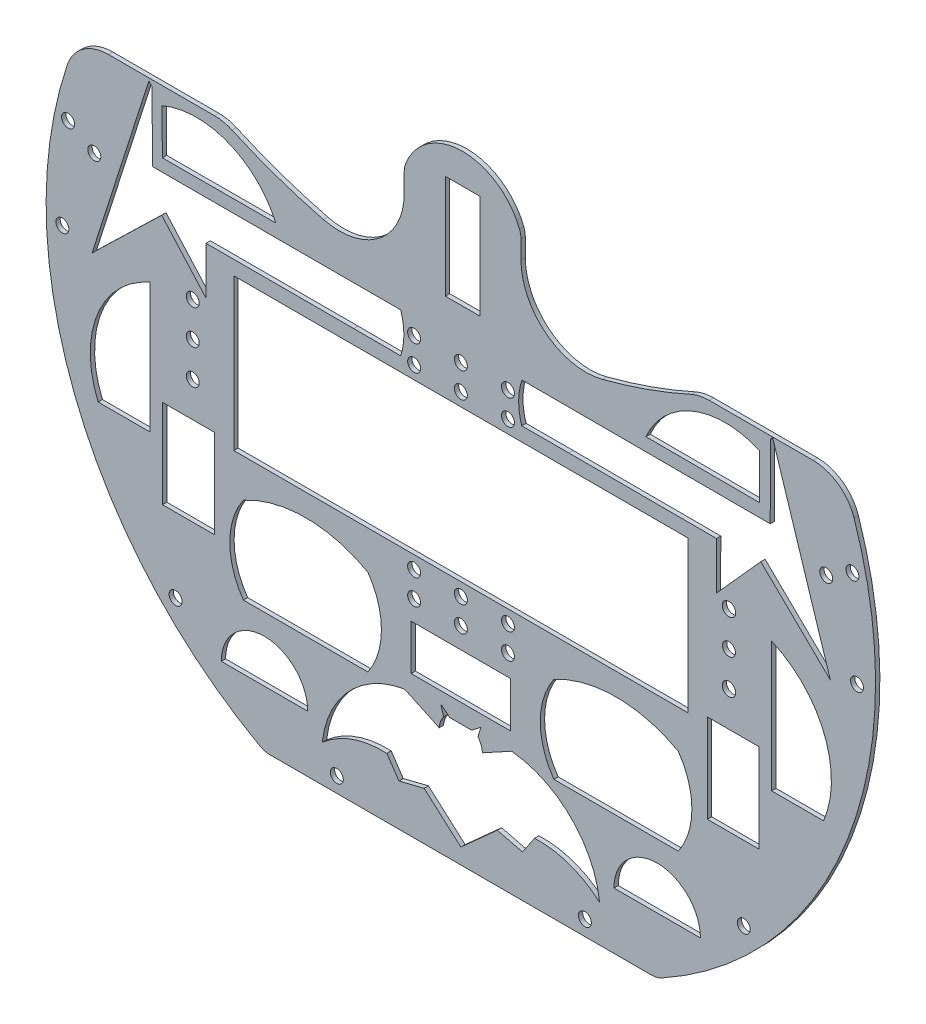
from build123d import *

# Parameters (mm, degrees)
CROQUIS1_R              = 1.5
CROQUIS1_W              = 23
CROQUIS1_H              = 10.5
CROQUIS1_R_2            = 1.55
CROQUIS1_W_2            = 8
CROQUIS1_H_2            = 24
SALIENTE_EXTRUIR1_DEPTH = 1


with BuildPart() as part:
    # Croquis1 → Saliente-Extruir1 (new body)
    with BuildSketch(Plane.XY):
        with BuildLine():
            ThreePointArc((309.850726744, 63.509654663), (309.599394258, 62.624115136), (309.514659431, 61.707508197))
            Line((309.514659431, 61.707508197), (309.514659431, 57.327552176))
            ThreePointArc((309.514659431, 57.327552176), (303.729213281, 45.491505651), (290.835726452, 42.785700432))
            ThreePointArc((290.835726452, 42.785700432), (280.128411441, 45.991903753), (269.737322706, 50.109136972))
            ThreePointArc((269.737322706, 50.109136972), (267.74260814, 50.759780707), (265.656038098, 50.97989188))
            Line((265.656038098, 50.97989188), (241.08166038, 50.97989188))
            ThreePointArc((241.08166038, 50.97989188), (235.230334816, 49.089268499), (231.591539837, 44.13228971))
            ThreePointArc((231.591539837, 44.13228971), (233.256794927, -20.949922712), (276.095054953, -69.973905885))
            ThreePointArc((276.095054953, -69.973905885), (277.267588571, -70.441900659), (278.519966502, -70.601286078))
            Line((278.519966502, -70.601286078), (293.924380078, -70.601286078))
            Line((293.924380078, -70.601286078), (366.696152251, -70.601286078))
            ThreePointArc((366.696152251, -70.601286078), (367.948530182, -70.441900659), (369.121063801, -69.973905885))
            ThreePointArc((369.121063801, -69.973905885), (412.002341733, -20.83942385), (413.549540259, 44.357259338))
            ThreePointArc((413.549540259, 44.357259338), (409.908538666, 49.29800924), (404.067243855, 51.18140435))
            Line((404.067243855, 51.18140435), (380.008708846, 51.18140435))
            ThreePointArc((380.008708846, 51.18140435), (377.904907933, 50.95760104), (375.895274543, 50.296208695))
            ThreePointArc((375.895274543, 50.296208695), (365.751190215, 46.2242243), (355.299933141, 43.021923672))
            ThreePointArc((355.299933141, 43.021923672), (342.343405641, 45.666690288), (336.514525798, 57.536423018))
            Line((336.514525798, 57.536423018), (336.514525798, 61.707508197))
            ThreePointArc((336.514525798, 61.707508197), (336.429790971, 62.624115136), (336.178458485, 63.509654663))
            ThreePointArc((336.178458485, 63.509654663), (323.014592614, 72.53553857), (309.850726744, 63.509654663))
        make_face()
        with Locations((256.640896295, -50.101286078)):
            Circle(CROQUIS1_R, mode=Mode.SUBTRACT)
        with Locations((293.924380078, -67.101286078)):
            Circle(CROQUIS1_R, mode=Mode.SUBTRACT)
        with BuildLine():
            Line((287.201459209, -57.50788535), (267.201459209, -57.50788535))
            ThreePointArc((267.201459209, -57.50788535), (277.201459209, -47.50788535), (287.201459209, -57.50788535))
        make_face(mode=Mode.SUBTRACT)
        Polygon((259.608059377, -32.937061776), (253.608059377, -32.937061776), (253.608059377, -12.437061776), (265.608059377, -12.437061776), (265.608059377, -32.937061776), align=None, mode=Mode.SUBTRACT)
        with BuildLine():
            Line((250.731722484, 10.184978786), (250.731722484, -19.815021214))
            Line((250.731722484, -19.815021214), (238.731722484, -19.815021214))
            ThreePointArc((238.731722484, -19.815021214), (238.55388558, -2.343886452), (250.731722484, 10.184978786))
        make_face(mode=Mode.SUBTRACT)
        with Locations((260.608059377, -4.351286077)):
            Circle(CROQUIS1_R, mode=Mode.SUBTRACT)
        with BuildLine():
            ThreePointArc((301.108080537, -22.687061776), (304.239766137, -32.687061776), (301.108080537, -42.687061776))
            Line((301.108080537, -42.687061776), (272.308080537, -42.687061776))
            ThreePointArc((272.308080537, -42.687061776), (269.176394936, -32.687061776), (272.308080537, -22.687061776))
            ThreePointArc((272.308080537, -22.687061776), (286.708080537, -18.980626962), (301.108080537, -22.687061776))
        make_face(mode=Mode.SUBTRACT)
        with Locations((311.80644959, -22.701286077)):
            Circle(CROQUIS1_R, mode=Mode.SUBTRACT)
        with Locations((322.608059377, -22.701286077)):
            Circle(CROQUIS1_R, mode=Mode.SUBTRACT)
        with Locations((311.80644959, -16.851286077)):
            Circle(CROQUIS1_R, mode=Mode.SUBTRACT)
        with Locations((322.608059377, -16.851286077)):
            Circle(CROQUIS1_R, mode=Mode.SUBTRACT)
        with BuildLine():
            Line((331.039483308, -59.416197143), (322.608059377, -67.00788535))
            Line((322.608059377, -67.00788535), (314.115647223, -59.484458572))
            Line((314.115647223, -59.484458572), (308.293872865, -60.935989946))
            Line((308.293872865, -60.935989946), (305.497908348, -56.790802083))
            ThreePointArc((305.497908348, -56.790802083), (297.524016311, -57.967163869), (290.57468702, -62.050496292))
            ThreePointArc((290.57468702, -62.050496292), (296.700568728, -48.781397839), (309.575833339, -41.865983052))
            Line((309.575833339, -41.865983052), (317.608059377, -45.629378016))
            ThreePointArc((317.608059377, -45.629378016), (317.926050133, -44.19732179), (318.644984002, -42.91863604))
            Line((318.644984002, -42.91863604), (318.642820451, -42.911559385))
            Line((318.642820451, -42.911559385), (317.961360482, -40.68260426))
            Line((317.961360482, -40.68260426), (320.108059377, -42.359789251))
            Line((320.108059377, -42.359789251), (322.608059377, -42.359789251))
            Line((322.608059377, -42.359789251), (325.108059377, -42.359789251))
            Line((325.108059377, -42.359789251), (327.254758271, -40.68260426))
            Line((327.254758271, -40.68260426), (326.573298302, -42.911559385))
            Line((326.573298302, -42.911559385), (326.571134752, -42.91863604))
            ThreePointArc((326.571134752, -42.91863604), (327.29006862, -44.19732179), (327.608059377, -45.629378016))
            Line((327.608059377, -45.629378016), (334.361262908, -41.934506878))
            ThreePointArc((334.361262908, -41.934506878), (348.087721137, -48.396503366), (354.701459209, -62.050496292))
            ThreePointArc((354.701459209, -62.050496292), (347.70490498, -57.902513314), (339.657222183, -56.722540654))
            Line((339.657222183, -56.722540654), (336.861257666, -60.867728516))
            Line((336.861257666, -60.867728516), (331.039483308, -59.416197143))
        make_face(mode=Mode.SUBTRACT)
        with Locations((351.291980078, -67.101286078)):
            Circle(CROQUIS1_R, mode=Mode.SUBTRACT)
        with BuildLine():
            ThreePointArc((358.014659544, -57.50788535), (368.014659544, -47.50788535), (378.014659544, -57.50788535))
            Line((378.014659544, -57.50788535), (358.014659544, -57.50788535))
        make_face(mode=Mode.SUBTRACT)
        with Locations((388.037027296, -50.101286078)):
            Circle(CROQUIS1_R, mode=Mode.SUBTRACT)
        with Locations((322.608059377, -32.75788535)):
            Rectangle(CROQUIS1_W, CROQUIS1_H, mode=Mode.SUBTRACT)
        with Locations((333.505439463, -22.701286077)):
            Circle(CROQUIS1_R, mode=Mode.SUBTRACT)
        with BuildLine():
            ThreePointArc((372.908059377, -22.687061776), (376.039744977, -32.687061776), (372.908059377, -42.687061776))
            Line((372.908059377, -42.687061776), (344.108059377, -42.687061776))
            ThreePointArc((344.108059377, -42.687061776), (340.976373776, -32.687061776), (344.108059377, -22.687061776))
            ThreePointArc((344.108059377, -22.687061776), (358.508059377, -18.980624104), (372.908059377, -22.687061776))
        make_face(mode=Mode.SUBTRACT)
        with Locations((333.505439463, -16.851286077)):
            Circle(CROQUIS1_R, mode=Mode.SUBTRACT)
        Polygon((391.608059377, -12.437061776), (391.608059377, -22.687061776), (391.608059377, -32.937061776), (379.608059377, -32.937061776), (379.608059377, -12.437061776), align=None, mode=Mode.SUBTRACT)
        with Locations((384.608059377, -4.351286077)):
            Circle(CROQUIS1_R_2, mode=Mode.SUBTRACT)
        with BuildLine():
            Line((406.484396269, -19.815021214), (394.484396269, -19.815021214))
            Line((394.484396269, -19.815021214), (394.484396269, 10.184978786))
            ThreePointArc((394.484396269, 10.184978786), (406.662233173, -2.343886452), (406.484396269, -19.815021214))
        make_face(mode=Mode.SUBTRACT)
        with Locations((230.456351063, 11.398713923)):
            Circle(CROQUIS1_R, mode=Mode.SUBTRACT)
        with Locations((260.608059377, 3.648713923)):
            Circle(CROQUIS1_R, mode=Mode.SUBTRACT)
        with Locations((260.608059377, 11.648713923)):
            Circle(CROQUIS1_R, mode=Mode.SUBTRACT)
        with Locations((237.850066081, 29.559654286)):
            Circle(CROQUIS1_R, mode=Mode.SUBTRACT)
        with Locations((231.787888255, 33.059654286)):
            Circle(CROQUIS1_R, mode=Mode.SUBTRACT)
        with BuildLine():
            Line((250.471865132, 50.372923914), (251.232957867, 49.522248793))
            Line((251.232957867, 49.522248793), (251.259201082, 33.620640627))
            Line((251.259201082, 33.620640627), (297.835307665, 33.620640627))
            Line((297.835307665, 33.620640627), (308.701459209, 33.620640627))
            ThreePointArc((308.701459209, 33.620640627), (309.439297107, 29.02161934), (308.701459209, 24.422598054))
            Line((308.701459209, 24.422598054), (297.851166076, 24.450299737))
            Line((297.851166076, 24.450299737), (263.676874646, 24.450299737))
            Line((263.676874646, 24.450299737), (263.676874646, 13.478905654))
            Line((263.676874646, 13.478905654), (253.424580574, 24.937918602))
            Line((253.424580574, 24.937918602), (237.324768948, 9.334151374))
            Line((237.324768948, 9.334151374), (250.471865132, 50.372923914))
        make_face(mode=Mode.SUBTRACT)
        with Locations((311.80644959, 24.148694548)):
            Circle(CROQUIS1_R, mode=Mode.SUBTRACT)
        with Locations((322.608059377, 24.148694548)):
            Circle(CROQUIS1_R, mode=Mode.SUBTRACT)
        with Locations((311.80644959, 29.998694548)):
            Circle(CROQUIS1_R, mode=Mode.SUBTRACT)
        with Locations((322.608059377, 29.998694548)):
            Circle(CROQUIS1_R, mode=Mode.SUBTRACT)
        with BuildLine():
            Line((279.812541184, 36.57695454), (253.593005368, 36.514981952))
            Line((253.593005368, 36.514981952), (253.484647579, 46.913395819))
            ThreePointArc((253.484647579, 46.913395819), (268.789341464, 47.197860479), (279.812541184, 36.57695454))
        make_face(mode=Mode.SUBTRACT)
        Polygon((272.608059377, 21.148713923), (283.608059377, 21.148713923), (361.608059377, 21.148713923), (372.608059377, 21.148713923), (375.108059377, 21.148713923), (375.108059377, -13.851286077), (372.908059377, -13.851286077), (272.308059377, -13.851286077), (270.108059377, -13.851286077), (270.108059377, 21.148713923), (272.308059377, 21.148713923), align=None, mode=Mode.SUBTRACT)
        with Locations((333.505439463, 24.148694548)):
            Circle(CROQUIS1_R, mode=Mode.SUBTRACT)
        with Locations((333.505439463, 29.998694548)):
            Circle(CROQUIS1_R, mode=Mode.SUBTRACT)
        with Locations((384.608059377, 3.648713923)):
            Circle(CROQUIS1_R, mode=Mode.SUBTRACT)
        with Locations((384.608059377, 11.648713923)):
            Circle(CROQUIS1_R_2, mode=Mode.SUBTRACT)
        with Locations((414.221552147, 11.398713923)):
            Circle(CROQUIS1_R, mode=Mode.SUBTRACT)
        with BuildLine():
            Line((394.151405418, 33.500405421), (394.207881843, 50.443807073))
            Line((394.207881843, 50.443807073), (394.707680127, 51.065310079))
            Line((394.707680127, 51.065310079), (408.044946606, 9.190500601))
            Line((408.044946606, 9.190500601), (391.971417025, 24.821339763))
            Line((391.971417025, 24.821339763), (381.699853342, 13.379596408))
            Line((381.699853342, 13.379596408), (381.718316867, 24.350974954))
            Line((381.718316867, 24.350974954), (347.544073829, 24.40848614))
            Line((347.544073829, 24.40848614), (336.693749442, 24.399044223))
            ThreePointArc((336.693749442, 24.399044223), (335.972891899, 29.000846221), (336.728676512, 33.597041043))
            Line((336.728676512, 33.597041043), (347.575364789, 33.578787357))
            Line((347.575364789, 33.578787357), (394.151405418, 33.500405421))
        make_face(mode=Mode.SUBTRACT)
        with Locations((407.098258666, 29.672214925)):
            Circle(CROQUIS1_R, mode=Mode.SUBTRACT)
        with Locations((413.160436493, 33.172214925)):
            Circle(CROQUIS1_R, mode=Mode.SUBTRACT)
        with Locations((323.014659431, 53.53553857)):
            Rectangle(CROQUIS1_W_2, CROQUIS1_H_2, mode=Mode.SUBTRACT)
        with BuildLine():
            Line((391.731471174, 46.913395819), (391.623113385, 36.514981952))
            Line((391.623113385, 36.514981952), (365.403577569, 36.57695454))
            ThreePointArc((365.403577569, 36.57695454), (376.426777289, 47.197860479), (391.731471174, 46.913395819))
        make_face(mode=Mode.SUBTRACT)
    extrude(amount=SALIENTE_EXTRUIR1_DEPTH)


solid = part.part
